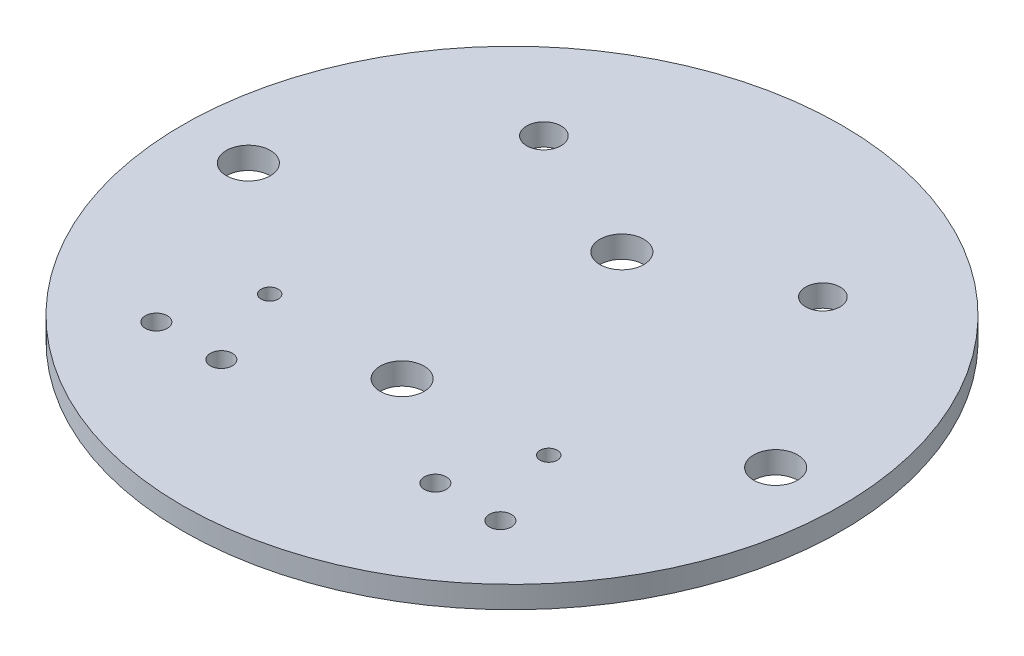
from build123d import *

# Parameters (mm, degrees)
SKETCH1_R           = 47.625
BOSS_EXTRUDE1_DEPTH = 3.175
SKETCH2_R           = 3.175
CUT_EXTRUDE1_DEPTH  = 263.398
SKETCH3_R           = 3.175
CUT_EXTRUDE2_DEPTH  = 25.4
SKETCH4_R           = 1.5875
SKETCH4_R_2         = 1.25
CUT_EXTRUDE3_DEPTH  = 50.8
CUT_EXTRUDE4_START  = -3.175
SKETCH5_R           = 1.984375
CUT_EXTRUDE4_DEPTH  = 50.8
SKETCH6_R           = 2.4892
CUT_EXTRUDE5_DEPTH  = 25.4


with BuildPart() as part:
    # Sketch1 → Boss-Extrude1 (new body)
    with BuildSketch(Plane(origin=(0, 0, 0), x_dir=(1, 0, 0), z_dir=(0, 1, 0))):
        with Locations(Location((0, 0, 0), (0, 0, 270))):
            Circle(SKETCH1_R)
    extrude(amount=BOSS_EXTRUDE1_DEPTH)

    # Sketch2 → Cut-Extrude1 (cut)
    with BuildSketch(Plane(origin=(-55.039702575, 231.775, -116.088398355), x_dir=(-1, 0, 0), z_dir=(0, 1, 0))):
        with Locations(Location((-93.139702575, 116.088398355, 0), (0, 0, 90))):
            Circle(SKETCH2_R)
        with Locations(Location((-16.939702575, 116.088398355, 0), (0, 0, 90))):
            Circle(SKETCH2_R)
    extrude(amount=-CUT_EXTRUDE1_DEPTH, mode=Mode.SUBTRACT)

    # Sketch3 → Cut-Extrude2 (cut)
    with BuildSketch(Plane(origin=(-28.264398128, -3.175, -82.371298873), x_dir=(1, 0, 0), z_dir=(0, -1, 0))):
        with Locations(Location((28.264398128, 98.246298873, 0), (0, 0, 90))):
            Circle(SKETCH3_R)
        with Locations(Location((28.264398128, 66.496298873, 0), (0, 0, 90))):
            Circle(SKETCH3_R)
    extrude(amount=-CUT_EXTRUDE2_DEPTH, mode=Mode.SUBTRACT)

    # Sketch4 → Cut-Extrude3 (cut)
    with BuildSketch(Plane(origin=(-28.264398128, -3.175, -82.371298873), x_dir=(-1, 0, 0), z_dir=(0, -1, 0))):
        with Locations(Location((-3.404148128, -108.914298873, 0), (0, 0, 270))):
            Circle(SKETCH4_R)
        with Locations(Location((-12.802148128, -108.914298873, 0), (0, 0, 270))):
            Circle(SKETCH4_R)
        with Locations(Location((-43.726648128, -108.914298873, 0), (0, 0, 270))):
            Circle(SKETCH4_R)
        with Locations(Location((-53.124648128, -108.914298873, 0), (0, 0, 270))):
            Circle(SKETCH4_R)
        with Locations(Location((-8.103148128, -97.230298873, 0), (0, 0, 270))):
            Circle(SKETCH4_R_2)
        with Locations(Location((-48.425648128, -97.230298873, 0), (0, 0, 270))):
            Circle(SKETCH4_R_2)
    extrude(amount=-CUT_EXTRUDE3_DEPTH, mode=Mode.SUBTRACT)

    # Sketch5 → Cut-Extrude4 (cut)
    with BuildSketch(Plane(origin=(-28.264398128, -3.175, -82.371298873), x_dir=(1, 0, 0), z_dir=(0, -1, 0)).offset(CUT_EXTRUDE4_START)):
        with Locations(Location((8.103148128, 57.606298873, 0), (0, 0, 90))):
            Circle(SKETCH5_R)
        with Locations(Location((48.425648128, 57.606298873, 0), (0, 0, 90))):
            Circle(SKETCH5_R)
    extrude(amount=-CUT_EXTRUDE4_DEPTH, mode=Mode.SUBTRACT)

    # Sketch6 → Cut-Extrude5 (cut)
    with BuildSketch(Plane(origin=(-28.264398128, 3.175, -82.371298873), x_dir=(1, 0, 0), z_dir=(0, 1, 0))):
        with Locations(Location((8.103148128, -57.606298873, 0), (0, 0, 270))):
            Circle(SKETCH6_R)
        with Locations(Location((48.425648128, -57.606298873, 0), (0, 0, 270))):
            Circle(SKETCH6_R)
    extrude(amount=-CUT_EXTRUDE5_DEPTH, mode=Mode.SUBTRACT)


solid = part.part
